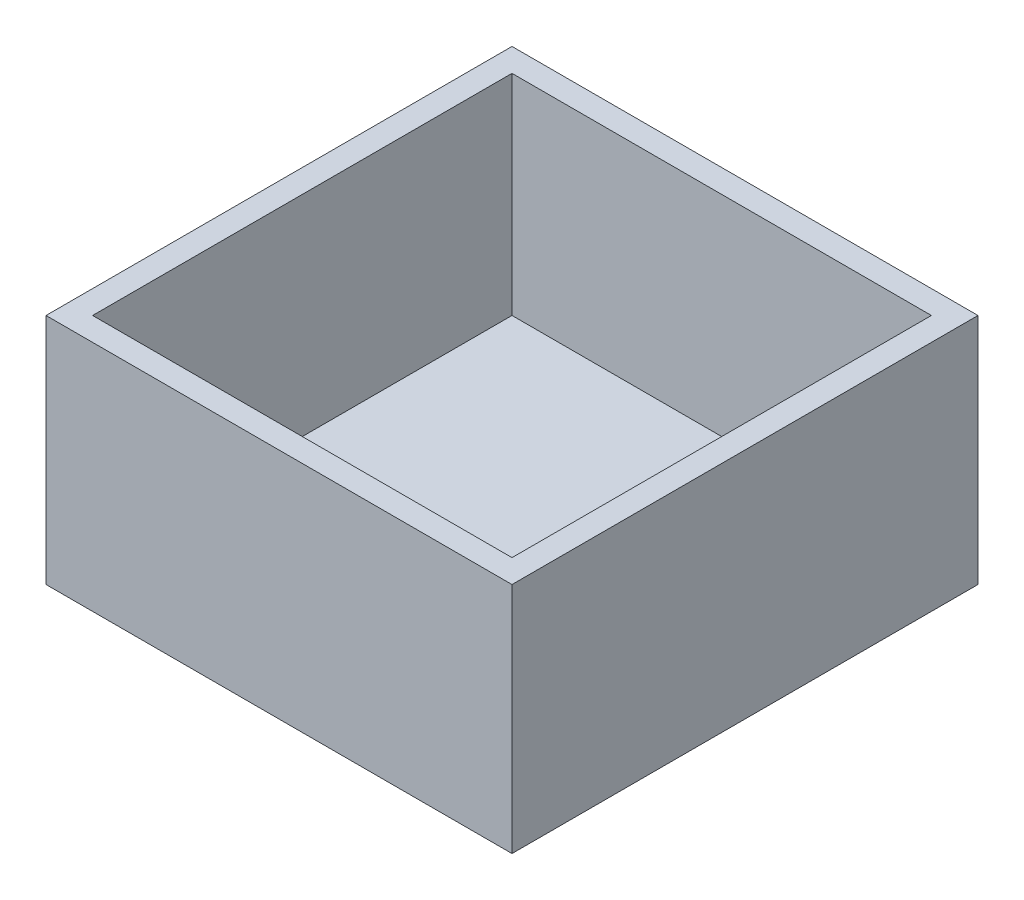
from build123d import *

# Parameters (mm, degrees)
SKETCH1_W           = 100
SKETCH1_H           = 100
BOSS_EXTRUDE1_DEPTH = 50
SHELL1_T            = -5


with BuildPart() as part:
    # Sketch1 → Boss-Extrude1 (new body)
    with BuildSketch(Plane(origin=(0, 0, 0), x_dir=(1, 0, 0), z_dir=(0, 1, 0))):
        Rectangle(SKETCH1_W, SKETCH1_H)
    extrude(amount=BOSS_EXTRUDE1_DEPTH)

    # Shell1
    shell1_openings = [part.faces().sort_by_distance(p)[0] for p in [
        (0, 50, 0),
    ]]
    offset(amount=SHELL1_T, openings=shell1_openings, kind=Kind.INTERSECTION)


solid = part.part
